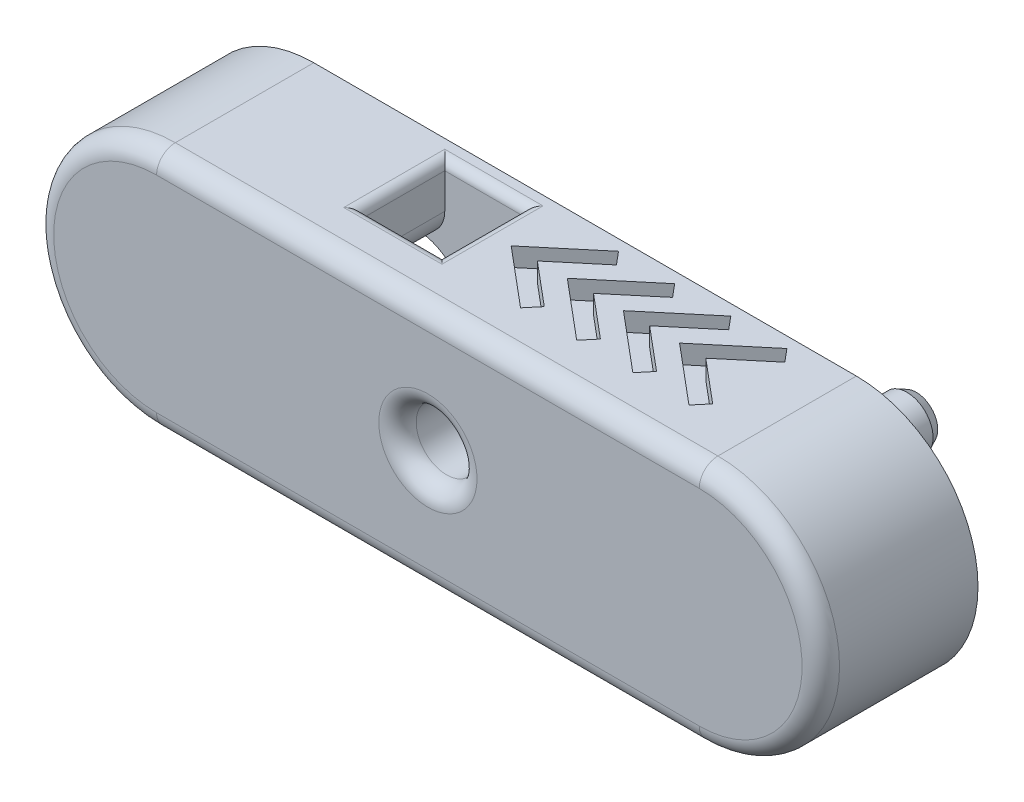
from build123d import *
from OCP.BRepFilletAPI import BRepFilletAPI_MakeChamfer

# Parameters (mm, degrees)
SKETCH1_R             = 2.8
BOSS_EXTRUDE1_DEPTH   = 6.4
BOSS_EXTRUDE1_2_DEPTH = 6.4
BOSS_EXTRUDE1_3_DEPTH = 6.4
SKETCH1_3_R           = 5.05
BOSS_EXTRUDE2_DEPTH   = 2
BOSS_EXTRUDE3_DEPTH   = 8.8
SKETCH6_R             = 5.05
SKETCH6_R_2           = 3.25
BOSS_EXTRUDE4_DEPTH   = 6
SKETCH6_4_R           = 5.05
CUT_EXTRUDE1_DEPTH    = 4
FILLET1_R             = 2
FILLET2_R             = 1
CHAMFER1_SIZE         = 0.5
CHAMFER1_SIZE2        = 1
CUT_EXTRUDE2_DEPTH    = 2


with BuildPart() as part:
    # Sketch1 → Boss-Extrude1 (new body)
    with BuildSketch(Plane.XY):
        with Locations((29, 6)):
            Circle(SKETCH1_R)
    extrude(amount=-BOSS_EXTRUDE1_DEPTH)



with BuildPart() as body_2:
    # Sketch1 → Boss-Extrude1 2 (new body)
    with BuildSketch(Plane.XY):
        with Locations((29, -6)):
            Circle(SKETCH1_R)
    extrude(amount=-BOSS_EXTRUDE1_2_DEPTH)


with BuildPart() as body_3:
    # Sketch1 → Boss-Extrude1 3 (new body)
    with BuildSketch(Plane.XY):
        with Locations((-35, 0)):
            Circle(SKETCH1_R)
    extrude(amount=-BOSS_EXTRUDE1_3_DEPTH)


with BuildPart() as part_1:
    add(part.part)

    add(body_2.part)  # Boss-Extrude2 merges body 2

    add(body_3.part)  # Boss-Extrude2 merges body 3
    # Sketch1<3> → Boss-Extrude2 (add)
    with BuildSketch(Plane.XY):
        with BuildLine():
            Line((29, 13), (-29, 13))
            ThreePointArc((-29, 13), (-42, 0), (-29, -13))
            Line((-29, -13), (29, -13))
            ThreePointArc((29, -13), (42, 0), (29, 13))
        make_face()
        with Locations((-16, 0)):
            Circle(SKETCH1_3_R, mode=Mode.SUBTRACT)
        Circle(SKETCH1_3_R, mode=Mode.SUBTRACT)
    extrude(amount=BOSS_EXTRUDE2_DEPTH)

    # Sketch5 → Boss-Extrude3 (add)
    with BuildSketch(Plane.XY.offset(2)):
        with BuildLine():
            Line((-4.5, -9.55), (-4.5, -13))
            Line((-4.5, -13), (29, -13))
            ThreePointArc((29, -13), (42, 0), (29, 13))
            Line((29, 13), (-4.5, 13))
            Line((-4.5, 13), (-4.5, 9.55))
            ThreePointArc((-4.5, 9.55), (-3.181980515, 6.368019485), (0, 5.05))
            ThreePointArc((0, 5.05), (5.05, 0), (0, -5.05))
            ThreePointArc((0, -5.05), (-3.181980515, -6.368019485), (-4.5, -9.55))
        make_face()
        with BuildLine():
            Line((-13, 8.25), (-13, 13))
            Line((-13, 13), (-29, 13))
            ThreePointArc((-29, 13), (-42, 0), (-29, -13))
            Line((-29, -13), (-13, -13))
            Line((-13, -13), (-13, -8.25))
            ThreePointArc((-13, -8.25), (-13.878679656, -6.128679656), (-16, -5.25))
            ThreePointArc((-16, -5.25), (-21.25, 0), (-16, 5.25))
            ThreePointArc((-16, 5.25), (-13.878679656, 6.128679656), (-13, 8.25))
        make_face()
    extrude(amount=BOSS_EXTRUDE3_DEPTH)

    # Sketch6 → Boss-Extrude4 (add)
    # profile 1 of 3: a face of its own
    with BuildSketch(Plane.XY.offset(10.8)):
        with BuildLine():
            ThreePointArc((-16, -5.25), (-21.25, 0), (-16, 5.25))
            ThreePointArc((-16, 5.25), (-13.878679656, 6.128679656), (-13, 8.25))
            Line((-13, 8.25), (-13, 13))
            Line((-13, 13), (-29, 13))
            ThreePointArc((-29, 13), (-42, 0), (-29, -13))
            Line((-29, -13), (-13, -13))
            Line((-13, -13), (-13, -8.25))
            ThreePointArc((-13, -8.25), (-13.878679656, -6.128679656), (-16, -5.25))
        make_face()
    # profile 2 of 3: a face of its own
    with BuildSketch(Plane.XY.offset(10.8)):
        with BuildLine():
            ThreePointArc((29, -13), (42, 0), (29, 13))
            Line((29, 13), (-13, 13))
            Line((-13, 13), (-13, 8.25))
            ThreePointArc((-13, 8.25), (-13.878679656, 6.128679656), (-16, 5.25))
            ThreePointArc((-16, 5.25), (-21.25, 0), (-16, -5.25))
            ThreePointArc((-16, -5.25), (-13.878679656, -6.128679656), (-13, -8.25))
            Line((-13, -8.25), (-13, -13))
            Line((-13, -13), (29, -13))
        make_face()
        with Locations((-16, 0)):
            Circle(SKETCH6_R, mode=Mode.SUBTRACT)
        Circle(SKETCH6_R_2, mode=Mode.SUBTRACT)
    # profile 3 of 3: a face of its own
    with BuildSketch(Plane.XY.offset(10.8)):
        with Locations((-16, 0)):
            Circle(SKETCH6_R)
    extrude(amount=BOSS_EXTRUDE4_DEPTH)

    # Sketch6<4> → Cut-Extrude1 (cut)
    with BuildSketch(Plane.XY.offset(10.8)):
        with Locations((-16, 0)):
            Circle(SKETCH6_4_R)
    extrude(amount=CUT_EXTRUDE1_DEPTH, mode=Mode.SUBTRACT)

    # Fillet1
    fillet1_edges = [part_1.edges().sort_by_distance(p)[0] for p in [
        (-3.25, 0, 16.8),
        (42, 0, 16.8),
        (0, 13, 16.8),
        (-42, 0, 16.8),
        (0, -13, 16.8),
    ]]
    fillet(fillet1_edges, radius=FILLET1_R)

    # Fillet2
    fillet2_edges = [part_1.edges().sort_by_distance(p)[0] for p in [
        (-8.75, 13, 2),
        (-4.5, 13, 6.4),
        (-4.5, -13, 6.4),
        (-8.75, -13, 2),
        (-13, -13, 6.4),
        (-13, 13, 6.4),
        (-8.75, 13, 10.8),
        (-8.75, -13, 10.8),
    ]]
    fillet(fillet2_edges, radius=FILLET2_R)

    # Chamfer1: one chamfer whose edges measure the first distance from different faces: ONE call of the kernel's chamfer builder (chamfer() names one face for all edges)
    chamfer1_edges_1 = [part_1.edges().sort_by_distance(p)[0] for p in [
        (26.2, 6, -6.4),
    ]]
    chamfer1_side_1 = [part_1.faces().sort_by_distance(p)[0] for p in [
        (29, 6, -6.4),
    ]]
    chamfer1_edges_2 = [part_1.edges().sort_by_distance(p)[0] for p in [
        (26.2, -6, -6.4),
    ]]
    chamfer1_side_2 = [part_1.faces().sort_by_distance(p)[0] for p in [
        (29, -6, -6.4),
    ]]
    chamfer1_edges_3 = [part_1.edges().sort_by_distance(p)[0] for p in [
        (-37.8, 0, -6.4),
    ]]
    chamfer1_side_3 = [part_1.faces().sort_by_distance(p)[0] for p in [
        (-35, 0, -6.4),
    ]]
    chamfer1 = BRepFilletAPI_MakeChamfer(part_1.part.solid().wrapped)
    for e in chamfer1_edges_1:
        chamfer1.Add(CHAMFER1_SIZE, CHAMFER1_SIZE2, e.wrapped, chamfer1_side_1[0].wrapped)  # the first distance lies on this face
    for e in chamfer1_edges_2:
        chamfer1.Add(CHAMFER1_SIZE, CHAMFER1_SIZE2, e.wrapped, chamfer1_side_2[0].wrapped)  # the first distance lies on this face
    for e in chamfer1_edges_3:
        chamfer1.Add(CHAMFER1_SIZE, CHAMFER1_SIZE2, e.wrapped, chamfer1_side_3[0].wrapped)  # the first distance lies on this face
    add(Compound.cast(chamfer1.Shape()), mode=Mode.REPLACE)

    # Sketch7 → Cut-Extrude2 (cut)
    with BuildSketch(Plane(origin=(0, 13, 0), x_dir=(1, 0, 0), z_dir=(0, 1, 0))):
        Polygon((-1.5, -6.4), (4.73955185, -11.635605656), (5.896569547, -10.256725658), (1.300302888, -6.4), (5.896569547, -2.543274342), (4.73955185, -1.164394344), align=None)
        Polygon((10.73955185, -1.164394344), (4.5, -6.4), (10.73955185, -11.635605656), (11.896569547, -10.256725658), (7.300302888, -6.4), (11.896569547, -2.543274342), align=None)
        Polygon((16.73955185, -1.164394344), (10.5, -6.4), (16.73955185, -11.635605656), (17.896569547, -10.256725658), (13.300302888, -6.4), (17.896569547, -2.543274342), align=None)
        Polygon((22.73955185, -1.164394344), (16.5, -6.4), (22.73955185, -11.635605656), (23.896569547, -10.256725658), (19.300302888, -6.4), (23.896569547, -2.543274342), align=None)
    extrude(amount=-CUT_EXTRUDE2_DEPTH, mode=Mode.SUBTRACT)


solid = part_1.part
